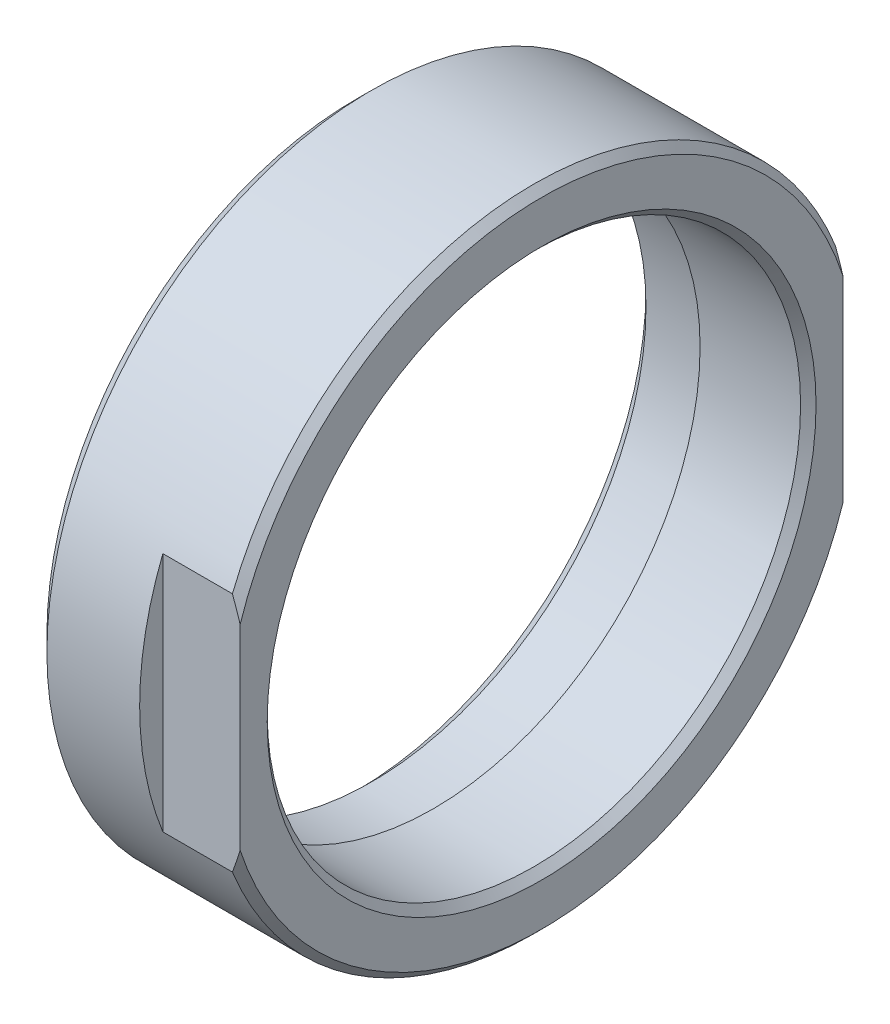
from build123d import *

# Parameters (mm, degrees)
ESQUISSE2_W             = 6.395173454
ESQUISSE2_H             = 30.286576169
ENL_V_MAT_EXTRU_1_DEPTH = 5


with BuildPart() as part:
    # Esquisse1 → Révolution1 (revolve)
    with BuildSketch(Plane.XY):
        Polygon((0, 17.75), (-4, 17.75), (-5, 18.75), (-5, 20), (-4, 21), (6.5, 21), (7, 20.5), (7, 17.75), (6.5, 17.25), (0, 17.25), align=None)
    revolve(axis=Axis((-33.075824176, 0, 0), (1, 0, 0)))

    # Esquisse2 → Enlèv. mat.-Extru.1 (cut)
    with BuildSketch(Plane(origin=(7, 0, 0), x_dir=(0, 0, -1), z_dir=(1, 0, 0))):
        with Locations((-22.697586727, -0.422322776)):
            Rectangle(ESQUISSE2_W, ESQUISSE2_H)
        with Locations((22.697586727, -0.422322776)):
            Rectangle(ESQUISSE2_W, ESQUISSE2_H)
    extrude(amount=-ENL_V_MAT_EXTRU_1_DEPTH, mode=Mode.SUBTRACT)


solid = part.part
